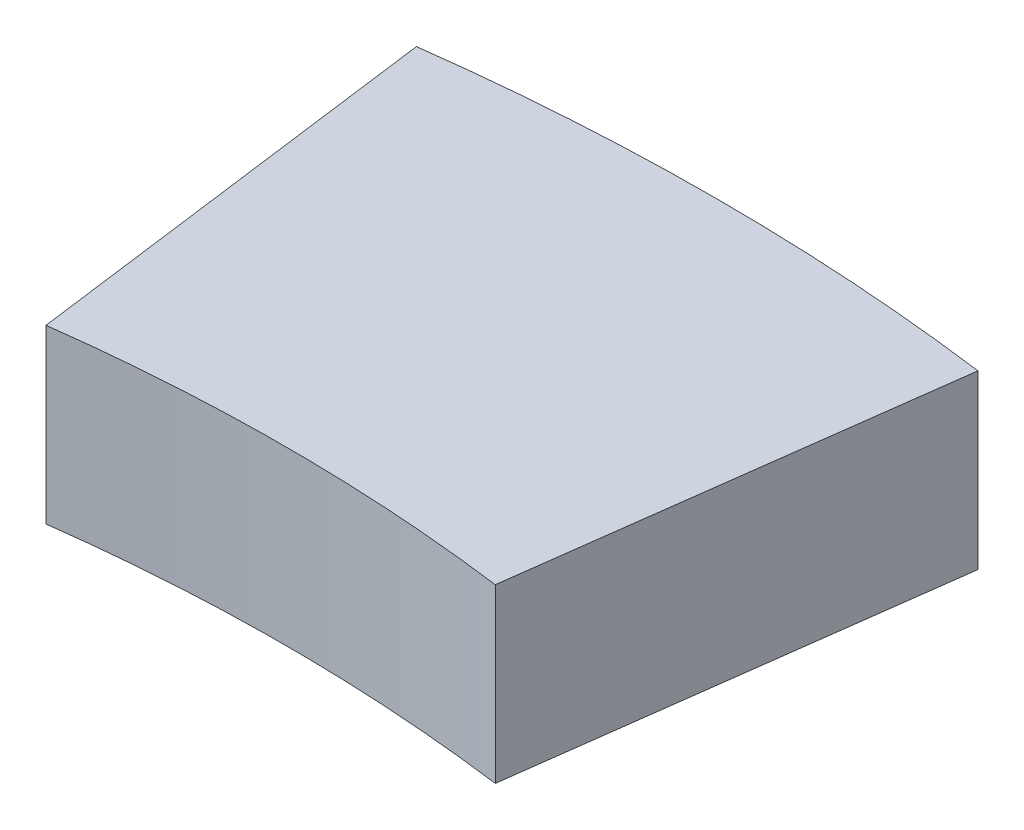
from build123d import *

# Parameters (mm, degrees)
BOSS_EXTRUDE1_DEPTH = 10


with BuildPart() as part:
    # Sketch1 → Boss-Extrude1 (new, symmetric)
    with BuildSketch(Plane(origin=(0, 0, 0), x_dir=(1, 0, 0), z_dir=(0, 1, 0))):
        with BuildLine():
            Line((32.631548055, 247.861215343), (26.105238444, 198.288972275))
            ThreePointArc((26.105238444, 198.288972275), (0, 200), (-26.105238444, 198.288972275))
            Line((-26.105238444, 198.288972275), (-32.631548055, 247.861215343))
            ThreePointArc((-32.631548055, 247.861215343), (0, 250), (32.631548055, 247.861215343))
        make_face()
    extrude(amount=BOSS_EXTRUDE1_DEPTH, both=True)


solid = part.part
